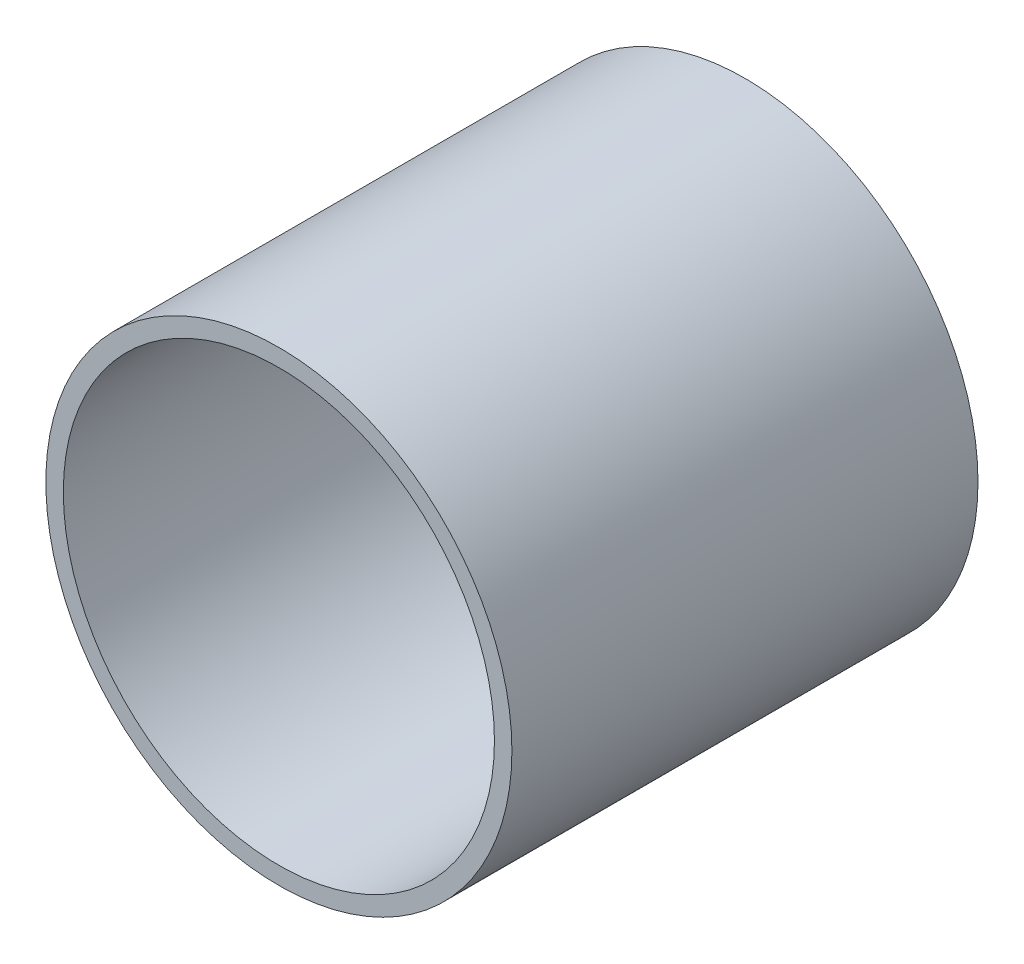
from build123d import *

# Parameters (mm, degrees)
SKETCH_1_R      = 20
SKETCH_1_R_2    = 18.5
EXTRUDE_1_DEPTH = 20


with BuildPart() as part:
    # 草图1 → 凸台-拉伸1 (new, symmetric)
    with BuildSketch(Plane.XY):
        Circle(SKETCH_1_R)
        Circle(SKETCH_1_R_2, mode=Mode.SUBTRACT)
    extrude(amount=EXTRUDE_1_DEPTH, both=True)


solid = part.part
